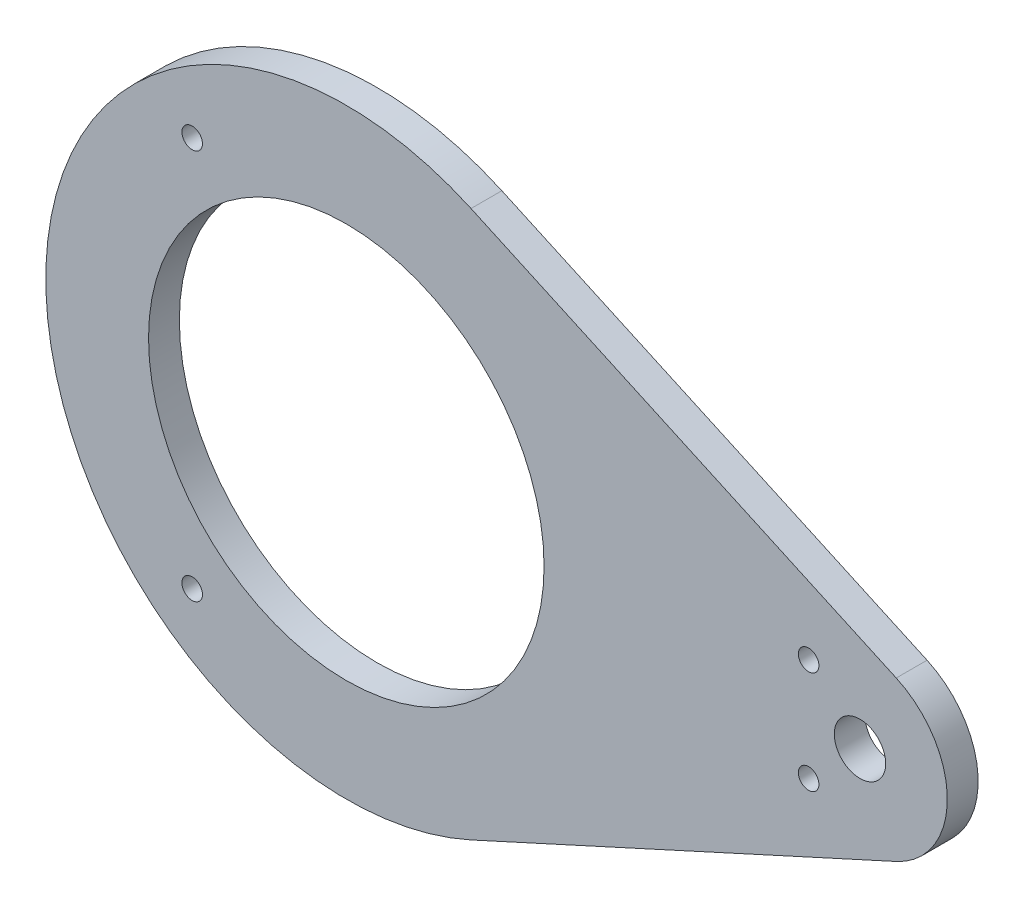
from build123d import *

# Parameters (mm, degrees)
ESQUISSE1_R                  = 19.25
ESQUISSE1_R_2                = 2.5
BOSS_EXTRU_1_DEPTH           = 42
ENL_V_MAT_EXTRU_1_DEPTH      = 74.881298321
ENL_V_MAT_EXTRU_1_DEPTH_BACK = 74.881298321
ESQUISSE2_W                  = 90
ESQUISSE2_H                  = 30
ESQUISSE3_R                  = 1
ENL_V_MAT_EXTRU_2_DEPTH      = 42
ENL_V_MAT_EXTRU_3_DEPTH      = 78.729096869
ENL_V_MAT_EXTRU_3_DEPTH_BACK = 78.729096869
ESQUISSE4_W                  = 87.75
ESQUISSE4_H                  = 39


with BuildPart() as part:
    # Esquisse1 → Boss.-Extru.1 (new body)
    with BuildSketch(Plane.XY):
        with BuildLine():
            Line((12.13875, 26.612276273), (53.5275, 7.733481994))
            ThreePointArc((53.5275, 7.733481994), (58.5, 0), (53.5275, -7.733481994))
            Line((53.5275, -7.733481994), (12.13875, -26.612276273))
            ThreePointArc((12.13875, -26.612276273), (-29.25, 0), (12.13875, 26.612276273))
        make_face()
        with Locations(Location((0, 0, 0), (0, 0, 180))):
            Circle(ESQUISSE1_R, mode=Mode.SUBTRACT)
        with Locations(Location((50, 0, 0), (0, 0, 180))):
            Circle(ESQUISSE1_R_2, mode=Mode.SUBTRACT)
    extrude(amount=BOSS_EXTRU_1_DEPTH)

    # Esquisse2 → Enlèv. mat.-Extru.1 (cut, two sides: drawn at the far end of the back side and taken through both)
    with BuildSketch(Plane(origin=(5.218823759, 0, 0), x_dir=(1, 0, 0), z_dir=(0, 1, 0)).offset(-ENL_V_MAT_EXTRU_1_DEPTH_BACK)):
        with Locations((-11.691323759, -21)):
            Rectangle(ESQUISSE2_W, ESQUISSE2_H)
    extrude(amount=ENL_V_MAT_EXTRU_1_DEPTH + ENL_V_MAT_EXTRU_1_DEPTH_BACK, mode=Mode.SUBTRACT)

    # Esquisse3 → Enlèv. mat.-Extru.2 (cut)
    with BuildSketch(Plane.XY.offset(42)):
        with Locations((45, 5)):
            Circle(ESQUISSE3_R)
        with Locations((45, -5)):
            Circle(ESQUISSE3_R)
        with Locations((-15, 19)):
            Circle(ESQUISSE3_R)
        with Locations((-15, -19)):
            Circle(ESQUISSE3_R)
    extrude(amount=-ENL_V_MAT_EXTRU_2_DEPTH, mode=Mode.SUBTRACT)

    # Esquisse4 → Enlèv. mat.-Extru.3 (cut, two sides: drawn at the far end of the back side and taken through both)
    with BuildSketch(Plane(origin=(0, 0, 0), x_dir=(1, 0, 0), z_dir=(0, 1, 0)).offset(-ENL_V_MAT_EXTRU_3_DEPTH_BACK)):
        with Locations((14.625, -22.5)):
            Rectangle(ESQUISSE4_W, ESQUISSE4_H)
    extrude(amount=ENL_V_MAT_EXTRU_3_DEPTH + ENL_V_MAT_EXTRU_3_DEPTH_BACK, mode=Mode.SUBTRACT)


solid = part.part
